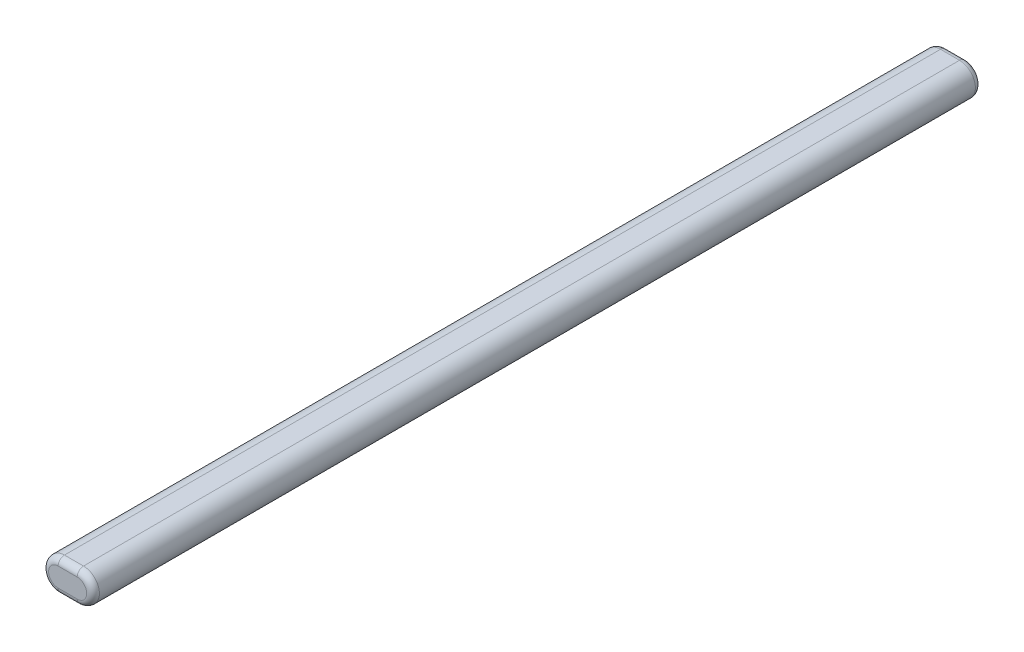
from build123d import *

# Parameters (mm, degrees)
EXTRUDE_1_DEPTH = 700
FILLET_1_R      = 5


with BuildPart() as part:
    # 草圖1 → 填料-伸長1 (new body)
    with BuildSketch(Plane.XY):
        with BuildLine():
            Line((-7.5, 12.5), (7.5, 12.5))
            ThreePointArc((7.5, 12.5), (20, 0), (7.5, -12.5))
            Line((7.5, -12.5), (-7.5, -12.5))
            ThreePointArc((-7.5, -12.5), (-20, 0), (-7.5, 12.5))
        make_face()
    extrude(amount=EXTRUDE_1_DEPTH)

    # 圓角1
    fillet_1_edges = [part.edges().sort_by_distance(p)[0] for p in [
        (20, 0, 700),
        (0, 12.5, 700),
        (-20, 0, 700),
        (0, 12.5, 0),
        (20, 0, 0),
        (0, -12.5, 0),
        (-20, 0, 0),
        (0, -12.5, 700),
    ]]
    fillet(fillet_1_edges, radius=FILLET_1_R)


solid = part.part
